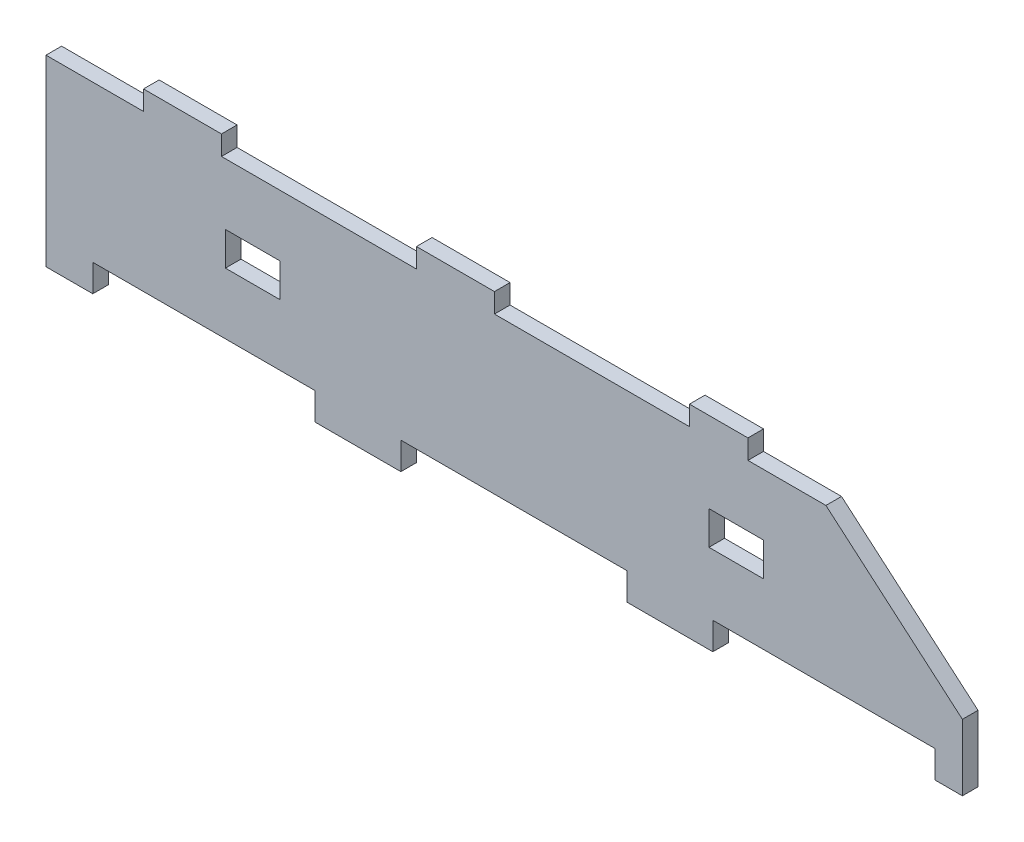
from build123d import *

# Parameters (mm, degrees)
BOSS_EXTRUDE2_DEPTH = 4
CUT_EXTRUDE1_DEPTH  = 4


with BuildPart() as part:
    # Sketch1 → Boss-Extrude2 (new body)
    with BuildSketch(Plane.XY):
        Polygon((-105.5, 0), (-48.5, 0), (-48.5, -7), (-26.5, -7), (-26.5, 0), (31.5, 0), (31.5, -7), (53.5, -7), (53.5, 0), (110.5, 0), (110.5, -7), (117.5, -7), (117.5, 0), (117.5, 10), (82.5, 40), (62.5, 40), (62.5, 45), (47.5, 45), (47.5, 40), (-2.5, 40), (-2.5, 45), (-22.5, 45), (-22.5, 40), (-72.5, 40), (-72.5, 45), (-92.5, 45), (-92.5, 40), (-117.5, 40), (-117.5, 0), (-117.5, -7), (-105.5, -7), align=None)
    extrude(amount=BOSS_EXTRUDE2_DEPTH)

    # Sketch2 → Cut-Extrude1 (cut)
    with BuildSketch(Plane.XY.offset(4)):
        Polygon((-71.5, 20), (-71.5, 24.3), (-57.5, 24.3), (-57.5, 15.7), (-71.5, 15.7), align=None)
        Polygon((52.5, 20), (52.5, 24.3), (66.5, 24.3), (66.5, 15.7), (52.5, 15.7), align=None)
    extrude(amount=-CUT_EXTRUDE1_DEPTH, mode=Mode.SUBTRACT)


solid = part.part
